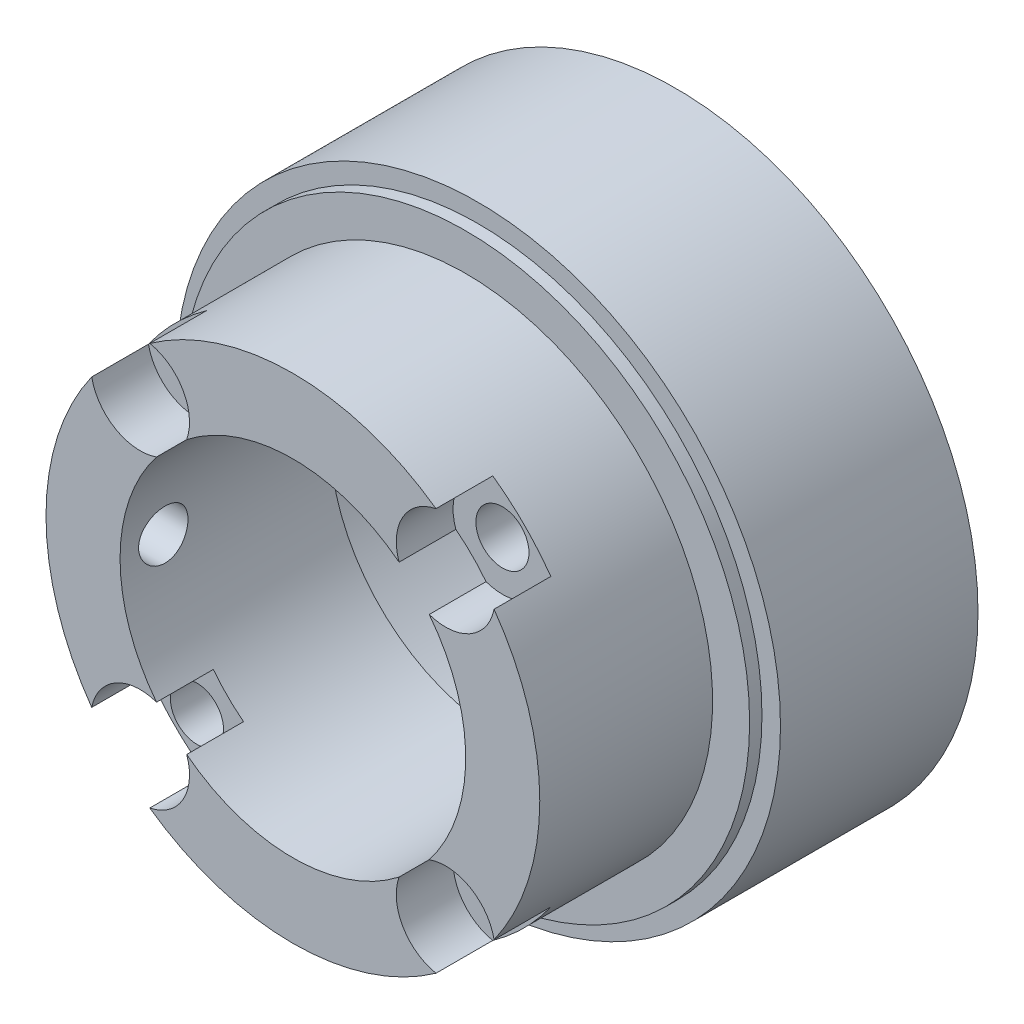
from build123d import *
from build123d.topology import SkipClean

# Parameters (mm, degrees)
SKETCH_1_R                = 20
SKETCH_1_R_2              = 14
EXTRUDE_1_DEPTH           = 14
EXTRUDE_START             = 3
SKETCH_2_R                = 24.5
SKETCH_2_R_2              = 14
EXTRUDE_2_DEPTH           = 3
EXTRUDE_START_2           = 14
SKETCH_3_R                = 24.5
SKETCH_3_R_2              = 21
EXTRUDE_3_DEPTH           = 14
HOLE_WIZARD_1_D           = 4.3
HOLE_WIZARD_1_CBORE_D     = 8
HOLE_WIZARD_1_CBORE_DEPTH = 4.6
CUT_EXTRUDE_START         = -1
SKETCH_6_R                = 24.5
SKETCH_6_R_2              = 23
CUT_EXTRUDE_1_DEPTH       = 1
CUT_EXTRUDE_2_REACH       = 55.568
CUT_EXTRUDE_2_END_RADIUS  = 14
SKETCH_14_R               = 2


with BuildPart() as part:
    # 草图1 → 凸台-拉伸1 (new body)
    with BuildSketch(Plane.XY):
        Circle(SKETCH_1_R)
        Circle(SKETCH_1_R_2, mode=Mode.SUBTRACT)
    extrude(amount=EXTRUDE_1_DEPTH)

    # 草图2 → 凸台-拉伸2 (add)
    with SkipClean():  # the faces are left unmerged after this step: merging them gives an invalid solid
        with BuildSketch(Plane(origin=(0, 0, 0), x_dir=(-1, 0, 0), z_dir=(0, 0, -1)).offset(EXTRUDE_START)):
            Circle(SKETCH_2_R)
            Circle(SKETCH_2_R_2, mode=Mode.SUBTRACT)
        extrude(amount=-EXTRUDE_2_DEPTH)

    # 草图3 → 凸台-拉伸3 (add)
    with SkipClean():  # the faces are left unmerged after this step: merging them gives an invalid solid
        with BuildSketch(Plane(origin=(0, 0, -3), x_dir=(-1, 0, 0), z_dir=(0, 0, -1)).offset(EXTRUDE_START_2)):
            Circle(SKETCH_3_R)
            Circle(SKETCH_3_R_2, mode=Mode.SUBTRACT)
        extrude(amount=-EXTRUDE_3_DEPTH)

    # 打孔尺寸根据内六角圆柱头螺钉的类型1 (through all)
    with Locations(Plane.XY.offset(14)):
        with Locations((12.374368671, -12.374368671), (12.374368671, 12.374368671), (-12.374368671, 12.374368671), (-12.374368671, -12.374368671)):
            CounterBoreHole(HOLE_WIZARD_1_D / 2, HOLE_WIZARD_1_CBORE_D / 2, HOLE_WIZARD_1_CBORE_DEPTH)

    # 草图6 → 切除-拉伸1 (cut)
    with SkipClean():  # the faces are left unmerged after this step: merging them gives an invalid solid
        with BuildSketch(Plane.XY.offset(CUT_EXTRUDE_START)):
            Circle(SKETCH_6_R)
            Circle(SKETCH_6_R_2, mode=Mode.SUBTRACT)
        extrude(amount=CUT_EXTRUDE_1_DEPTH, mode=Mode.SUBTRACT)

    # 切除-拉伸2: up to this cylinder (the profile starts outside it)
    with SkipClean():  # the faces are left unmerged after this step: merging them gives an invalid solid
        cut_extrude_2_end = Plane(origin=(0, 0, 10.5), z_dir=(0, 0, -1)) * Cylinder(CUT_EXTRUDE_2_END_RADIUS, 140.136, mode=Mode.PRIVATE)
        # 草图14 → 切除-拉伸2 (cut, up to the surface)
        with BuildSketch(Plane.ZY.offset(20), mode=Mode.PRIVATE) as cut_extrude_2_sk1:
            with Locations((10.5, 0)):
                Circle(SKETCH_14_R)
        cut_extrude_2_tool1 = extrude(cut_extrude_2_sk1.sketch, amount=-CUT_EXTRUDE_2_REACH, mode=Mode.PRIVATE) - cut_extrude_2_end
        add(cut_extrude_2_tool1.solids().sort_by_distance((-20, 0, 10.5))[0], mode=Mode.SUBTRACT)


solid = part.part
